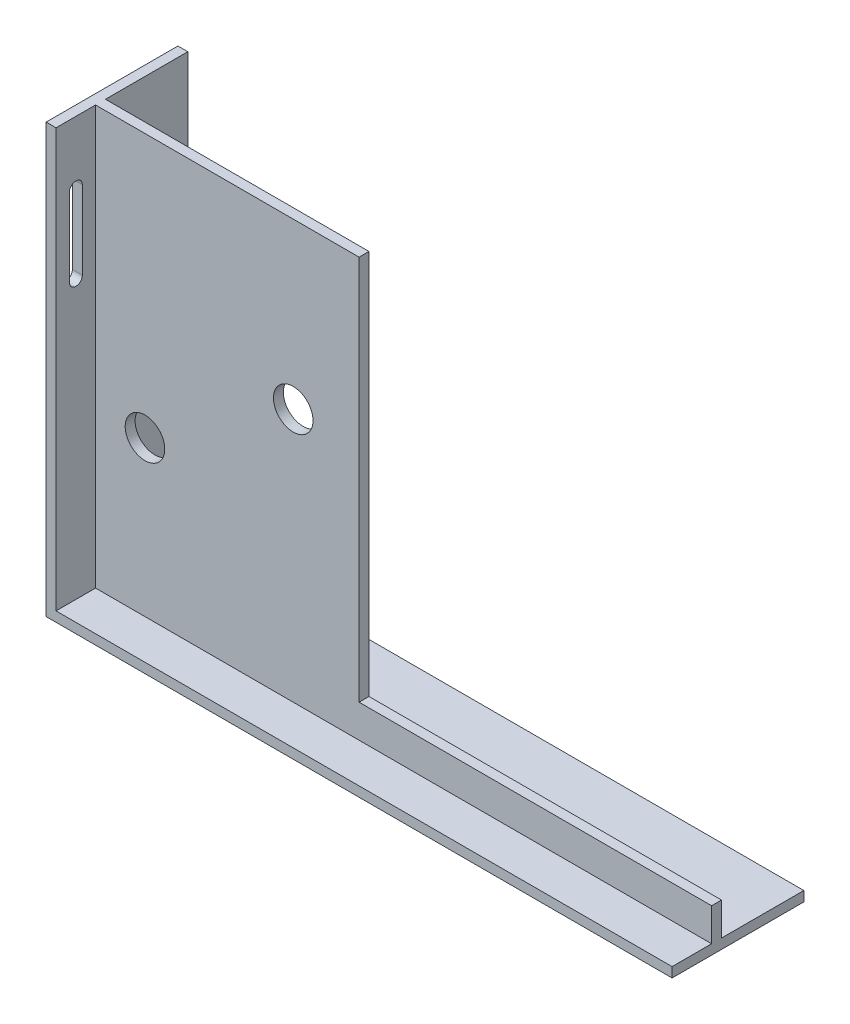
from build123d import *

# Parameters (mm, degrees)
SKETCH1_W           = 80
SKETCH1_H           = 130
BOSS_EXTRUDE1_DEPTH = 3
SKETCH2_R           = 6
CUT_EXTRUDE1_DEPTH  = 153.672852859
SKETCH3_W           = 40
SKETCH3_H           = 130
BOSS_EXTRUDE2_DEPTH = 3
SKETCH4_W           = 190
SKETCH4_H           = 40
BOSS_EXTRUDE3_DEPTH = 3
SKETCH5_W           = 107
SKETCH5_H           = 10
BOSS_EXTRUDE4_DEPTH = 3
CUT_EXTRUDE2_DEPTH  = 230.1156913


with BuildPart() as part:
    # Sketch1 → Boss-Extrude1 (new body)
    with BuildSketch(Plane.XY):
        with Locations((40, 65)):
            Rectangle(SKETCH1_W, SKETCH1_H)
    extrude(amount=BOSS_EXTRUDE1_DEPTH)

    # Sketch2 → Cut-Extrude1 (cut, through all)
    with BuildSketch(Plane.XY.offset(3)):
        with Locations((60, 80)):
            Circle(SKETCH2_R)
        with Locations((15, 50)):
            Circle(SKETCH2_R)
    extrude(amount=-CUT_EXTRUDE1_DEPTH, mode=Mode.SUBTRACT)

    # Sketch3 → Boss-Extrude2 (add)
    with BuildSketch(Plane.ZY):
        with Locations((-5, 65)):
            Rectangle(SKETCH3_W, SKETCH3_H)
    extrude(amount=BOSS_EXTRUDE2_DEPTH)

    # Sketch4 → Boss-Extrude3 (add)
    with BuildSketch(Plane.XZ):
        with Locations((92, -5)):
            Rectangle(SKETCH4_W, SKETCH4_H)
    extrude(amount=-BOSS_EXTRUDE3_DEPTH)

    # Sketch5 → Boss-Extrude4 (add)
    with BuildSketch(Plane(origin=(0, 0, 0), x_dir=(-1, 0, 0), z_dir=(0, 0, -1))):
        with Locations((-133.5, 8)):
            Rectangle(SKETCH5_W, SKETCH5_H)
    extrude(amount=-BOSS_EXTRUDE4_DEPTH)

    # Sketch6 → Cut-Extrude2 (cut, through all)
    with BuildSketch(Plane(origin=(0, 0, 0), x_dir=(0, 0, -1), z_dir=(1, 0, 0))):
        with BuildLine():
            Line((-7.023016919, 111.057268812), (-7.023016919, 87.264774426))
            ThreePointArc((-7.023016919, 87.264774426), (-8.975714476, 85.312076869), (-10.928412033, 87.264774426))
            Line((-10.928412033, 87.264774426), (-10.928412033, 111.057268812))
            ThreePointArc((-10.928412033, 111.057268812), (-8.975714476, 113.00996637), (-7.023016919, 111.057268812))
        make_face()
    extrude(amount=-CUT_EXTRUDE2_DEPTH, mode=Mode.SUBTRACT)


solid = part.part
